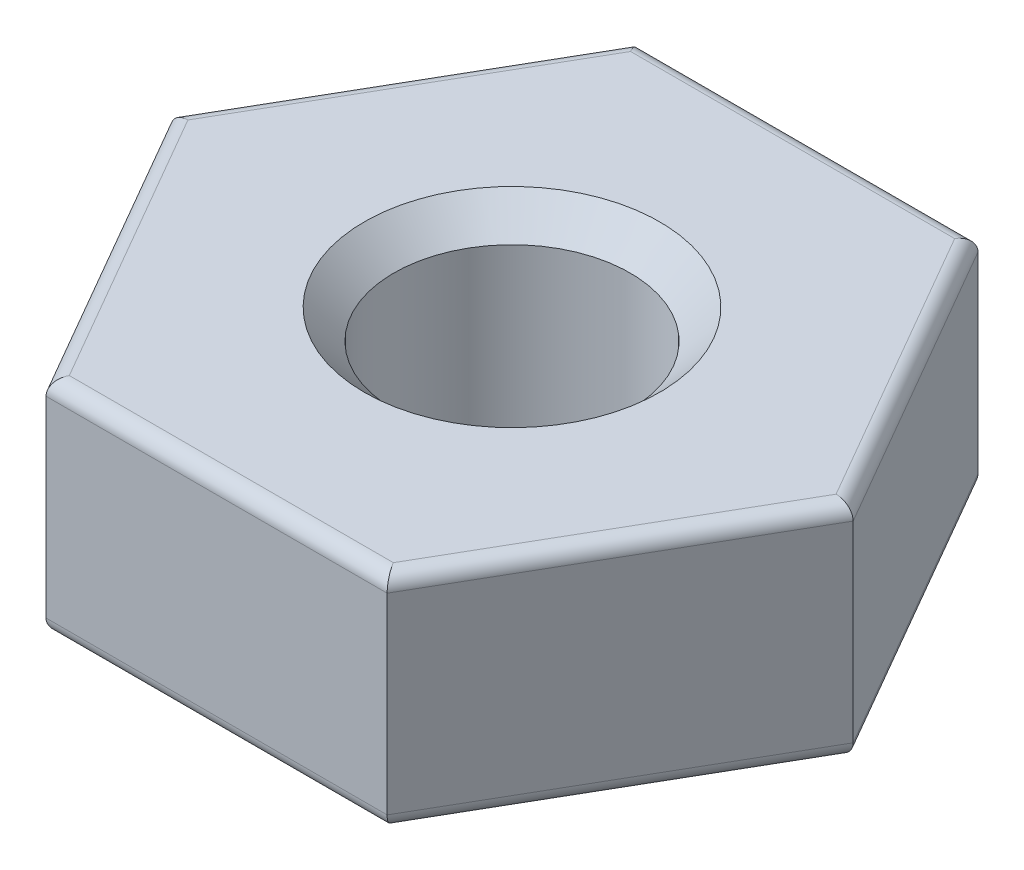
from build123d import *

# Parameters (mm, degrees)
BOSS_EXTRUDE1_DEPTH = 1.5
FILLET2_R           = 0.1


with BuildPart() as part:
    # Sketch1 → Boss-Extrude1 (new body)
    with BuildSketch(Plane(origin=(0, 0, 0), x_dir=(1, 0, 0), z_dir=(0, 1, 0))):
        Polygon((2.309401077, 0), (1.154700538, 2), (-1.154700538, 2), (-2.309401077, 0), (-1.154700538, -2), (1.154700538, -2), align=None)
    extrude(amount=BOSS_EXTRUDE1_DEPTH)

    # Fillet2
    fillet2_edges = [part.edges().sort_by_distance(p)[0] for p in [
        (0, 1.5, -2),
        (-1.732050808, 1.5, -1),
        (-1.732050808, 1.5, 1),
        (0, 1.5, 2),
        (1.732050808, 1.5, 1),
        (0, 0, 2),
        (-1.732050808, 0, 1),
        (-1.732050808, 0, -1),
        (0, 0, -2),
        (1.732050808, 0, -1),
        (1.732050808, 0, 1),
        (1.732050808, 1.5, -1),
    ]]
    fillet(fillet2_edges, radius=FILLET2_R)

    # Sketch3 → M2x0.4 Tapped Hole1 (revolve, cut)
    with BuildSketch(Plane(origin=(0, 1.5, 0), x_dir=(0, 0, 1), z_dir=(1, 0, 0))):
        Polygon((0, 0), (0, 1.5), (0.825, 1.5), (0.8, 1.475), (0.8, 0.2), (1, 0), align=None)
    revolve(axis=Axis((0, 7.85, 0), (0, -1, 0)), mode=Mode.SUBTRACT)


solid = part.part
